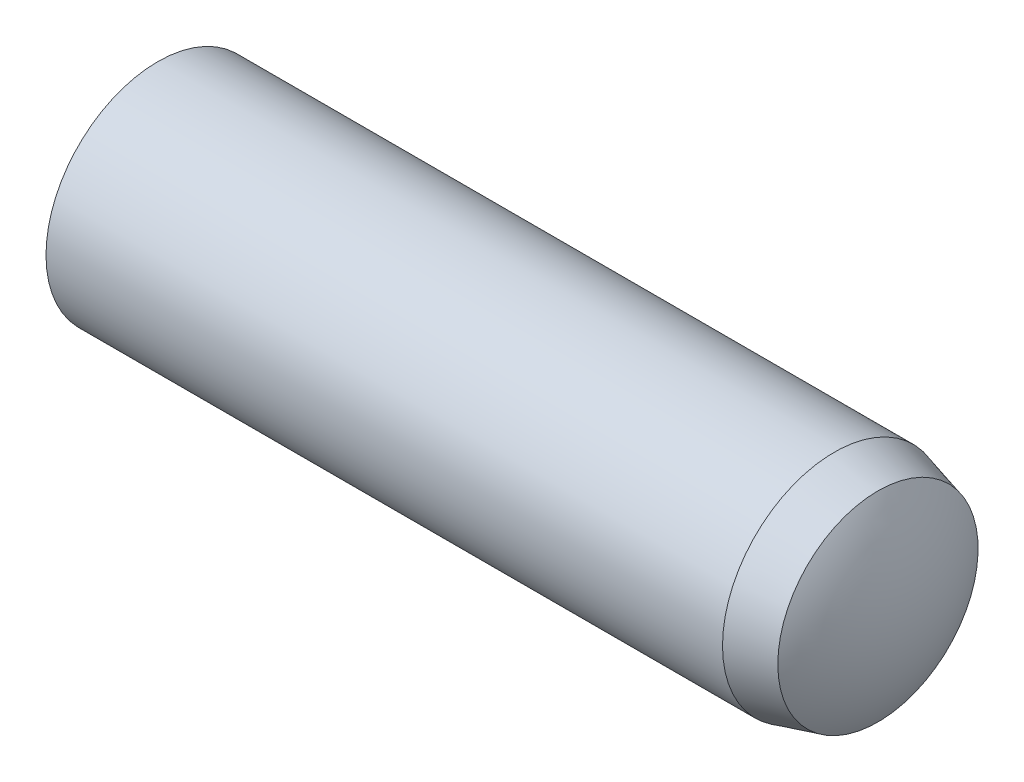
from build123d import *

# Parameters (mm, degrees)
EXTRUDE1_DEPTH      = 3.5
EXTRUDE1_DEPTH_BACK = 3.5
SKETCH2_R           = 1


with BuildPart() as part:
    # Sketch2 → Extrude1 (new, two sides: drawn at the far end of the back side and taken through both)
    with BuildSketch(Plane(origin=(0, 0, 0), x_dir=(0, 0, -1), z_dir=(1, 0, 0)).offset(-EXTRUDE1_DEPTH_BACK)):
        Circle(SKETCH2_R)
    extrude(amount=EXTRUDE1_DEPTH + EXTRUDE1_DEPTH_BACK)

    # Sketch5 → Cut-Revolve1 (revolve, cut)
    with BuildSketch(Plane.XY, mode=Mode.PRIVATE) as cut_revolve1_sk:
        with BuildLine():
            Line((2.85, 1), (2.85, 1.5))
            Line((2.85, 1.5), (4, 1.5))
            Line((4, 1.5), (4, 0))
            Line((4, 0), (3.5, 0))
            ThreePointArc((3.5, 0), (3.433685026, 0.46624026), (3.24, 0.895499815))
            Line((3.24, 0.895499815), (2.85, 1))
        make_face()
        with BuildLine():
            Line((-3.2, 1), (-3.2, 1.5))
            Line((-3.2, 1.5), (-4, 1.5))
            Line((-4, 1.5), (-4, 0))
            Line((-4, 0), (-3.5, 0))
            ThreePointArc((-3.5, 0), (-3.423384418, 0.522015325), (-3.2, 1))
        make_face()
    revolve(cut_revolve1_sk.sketch.rotate(Axis((-3.5, 0, 0), (1, 0, 0)), 90), axis=Axis((-3.5, 0, 0), (1, 0, 0)), mode=Mode.SUBTRACT)


solid = part.part
